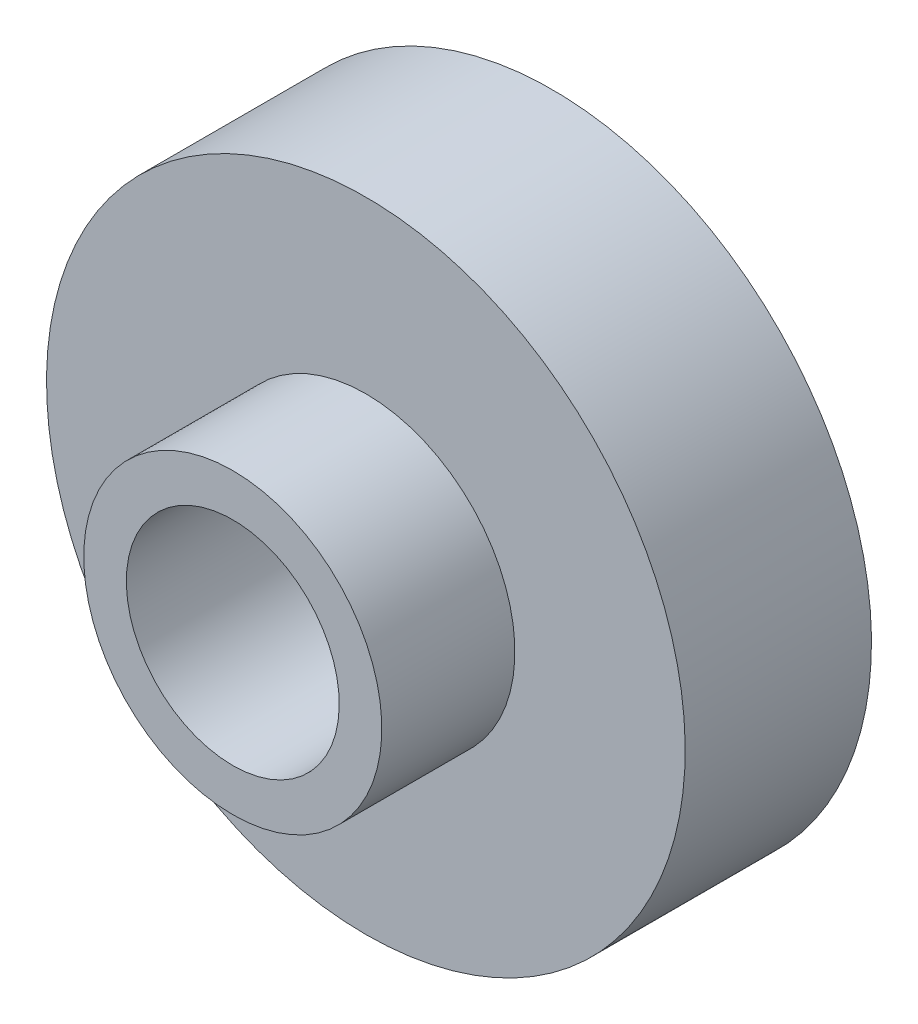
from build123d import *


with BuildPart() as part:
    # Sketch1 → Revolve1 (revolve)
    with BuildSketch(Plane(origin=(0, 0, 0), x_dir=(0, 0, -1), z_dir=(1, 0, 0)), mode=Mode.PRIVATE) as revolve1_sk:
        Polygon((-152.4, 71.12), (-152.4, 50.8), (-66.04, 50.8), (-66.04, 63.5), (-40.64, 63.5), (-40.64, 101.6), (-58.42, 101.6), (-58.42, 114.3), (0, 114.3), (0, 152.4), (-88.9, 152.4), (-88.9, 71.12), align=None)
    revolve(revolve1_sk.sketch.rotate(Axis((0, 0, 152.4), (0, 0, -1)), 180), axis=Axis((0, 0, 152.4), (0, 0, -1)))


solid = part.part
